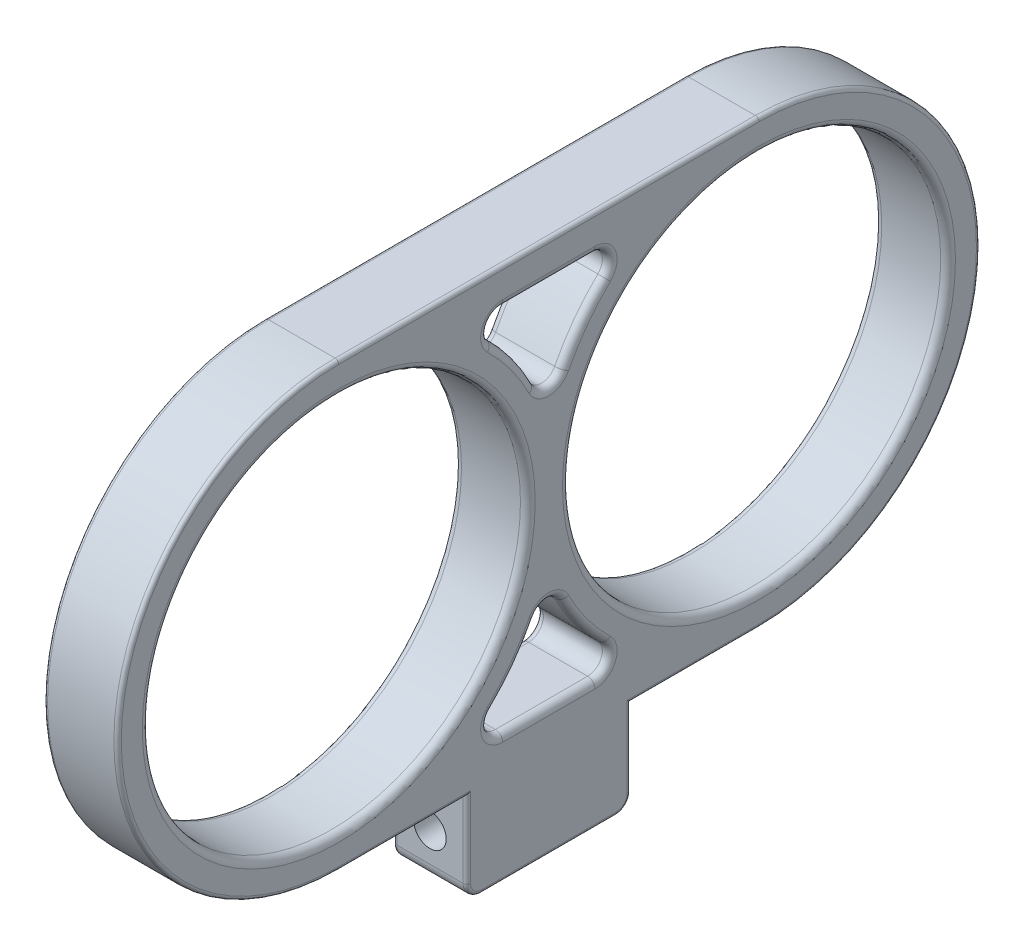
from build123d import *

# Parameters (mm, degrees)
SKETCH1_R           = 25.65
SKETCH1_W           = 22.2504
SKETCH1_H           = 12.3952
BOSS_EXTRUDE1_DEPTH = 10
FILLET1_R           = 2
FILLET4_R           = 2
FILLET3_R           = 1
FILLET2_R           = 0.5
CUT_EXTRUDE1_REACH  = 84.128
SKETCH2_R           = 2.2


with BuildPart() as part:
    # Sketch1 → Boss-Extrude1 (new body)
    # profile 1 of 2: a face of its own
    with BuildSketch(Plane(origin=(0, 0, 0), x_dir=(0, 0, -1), z_dir=(1, 0, 0))):
        with BuildLine():
            Line((0, 30), (57, 30))
            ThreePointArc((57, 30), (87, 0), (57, -30))
            Line((57, -30), (0, -30))
            ThreePointArc((0, -30), (-30, 0), (0, 30))
        make_face()
        Circle(SKETCH1_R, mode=Mode.SUBTRACT)
        with Locations((57, 0)):
            Circle(SKETCH1_R, mode=Mode.SUBTRACT)
        with BuildLine():
            Line((16.583123952, 25), (40.416876048, 25))
            ThreePointArc((40.416876048, 25), (33.141756061, 18.187473606), (28.5, 9.367496998))
            ThreePointArc((28.5, 9.367496998), (23.858243939, 18.187473606), (16.583123952, 25))
        make_face(mode=Mode.SUBTRACT)
        with BuildLine():
            Line((16.583123952, -25), (40.416876048, -25))
            ThreePointArc((40.416876048, -25), (33.141756061, -18.187473606), (28.5, -9.367496998))
            ThreePointArc((28.5, -9.367496998), (23.858243939, -18.187473606), (16.583123952, -25))
        make_face(mode=Mode.SUBTRACT)
    # profile 2 of 2: a face of its own
    with BuildSketch(Plane(origin=(0, 0, 0), x_dir=(0, 0, -1), z_dir=(1, 0, 0))):
        with Locations((28.5, -36.1976)):
            Rectangle(SKETCH1_W, SKETCH1_H)
    extrude(amount=BOSS_EXTRUDE1_DEPTH)

    # Fillet1
    fillet1_edges = [part.edges().sort_by_distance(p)[0] for p in [
        (5, -42.3952, -39.6252),
        (5, -42.3952, -17.3748),
    ]]
    fillet(fillet1_edges, radius=FILLET1_R)

    # Fillet4
    fillet4_edges = [part.edges().sort_by_distance(p)[0] for p in [
        (5, -25, -16.583123952),
        (5, -25, -40.416876048),
        (5, -9.367496998, -28.5),
        (5, 25, -40.416876048),
        (5, 25, -16.583123952),
        (5, 9.367496998, -28.5),
    ]]
    fillet(fillet4_edges, radius=FILLET4_R)

    # Fillet3
    fillet3_edges = [part.edges().sort_by_distance(p)[0] for p in [
        (0, 0, 25.65),
        (0, 0, -31.35),
        (10, 0, 25.65),
        (0, -25, -28.5),
        (10, -25, -28.5),
        (0, -17.844575194, -32.884213964),
        (10, -17.844575194, -32.884213964),
        (0, -17.844575194, -24.115786036),
        (10, -17.844575194, -24.115786036),
        (0, 17.844575194, -24.115786036),
        (10, 17.844575194, -24.115786036),
        (0, 17.844575194, -32.884213964),
        (10, 17.844575194, -32.884213964),
        (0, 25, -28.5),
        (10, 25, -28.5),
        (0, -23.75, -36.60545416),
        (10, -23.75, -36.60545416),
        (0, -12.551632211, -28.5),
        (10, -12.551632211, -28.5),
        (0, -23.75, -20.39454584),
        (10, -23.75, -20.39454584),
        (0, 12.551632211, -28.5),
        (10, 12.551632211, -28.5),
        (0, 23.75, -36.60545416),
        (10, 23.75, -36.60545416),
        (0, 23.75, -20.39454584),
        (10, 23.75, -20.39454584),
        (10, 0, -31.35),
    ]]
    fillet(fillet3_edges, radius=FILLET3_R)

    # Fillet2
    fillet2_edges = [part.edges().sort_by_distance(p)[0] for p in [
        (0, 0, 30),
        (0, 30, -28.5),
        (0, 0, -87),
        (0, -30, -48.3126),
        (0, -35.1976, -39.6252),
        (0, -35.1976, -17.3748),
        (0, -30, -8.6874),
        (10, -30, -8.6874),
        (10, -35.1976, -17.3748),
        (10, -35.1976, -39.6252),
        (0, -42.3952, -28.5),
        (0, -41.809413562, -17.960586438),
        (0, -41.809413562, -39.039413562),
        (10, -42.3952, -28.5),
        (10, -30, -48.3126),
        (10, -41.809413562, -17.960586438),
        (10, -41.809413562, -39.039413562),
        (10, 0, -87),
        (10, 30, -28.5),
        (10, 0, 30),
    ]]
    fillet(fillet2_edges, radius=FILLET2_R)

    # Sketch2 → Cut-Extrude1 (cut, up to next)
    with BuildSketch(Plane.XY.offset(-17.3748), mode=Mode.PRIVATE) as cut_extrude1_sk1:
        with Locations((5, -36.35)):
            Circle(SKETCH2_R)
    cut_extrude1_tool1 = extrude(cut_extrude1_sk1.sketch, amount=-CUT_EXTRUDE1_REACH, mode=Mode.PRIVATE) & part.part
    add(cut_extrude1_tool1.solids().sort_by_distance((5, -36.35, -17.3748))[0], mode=Mode.SUBTRACT)


solid = part.part
